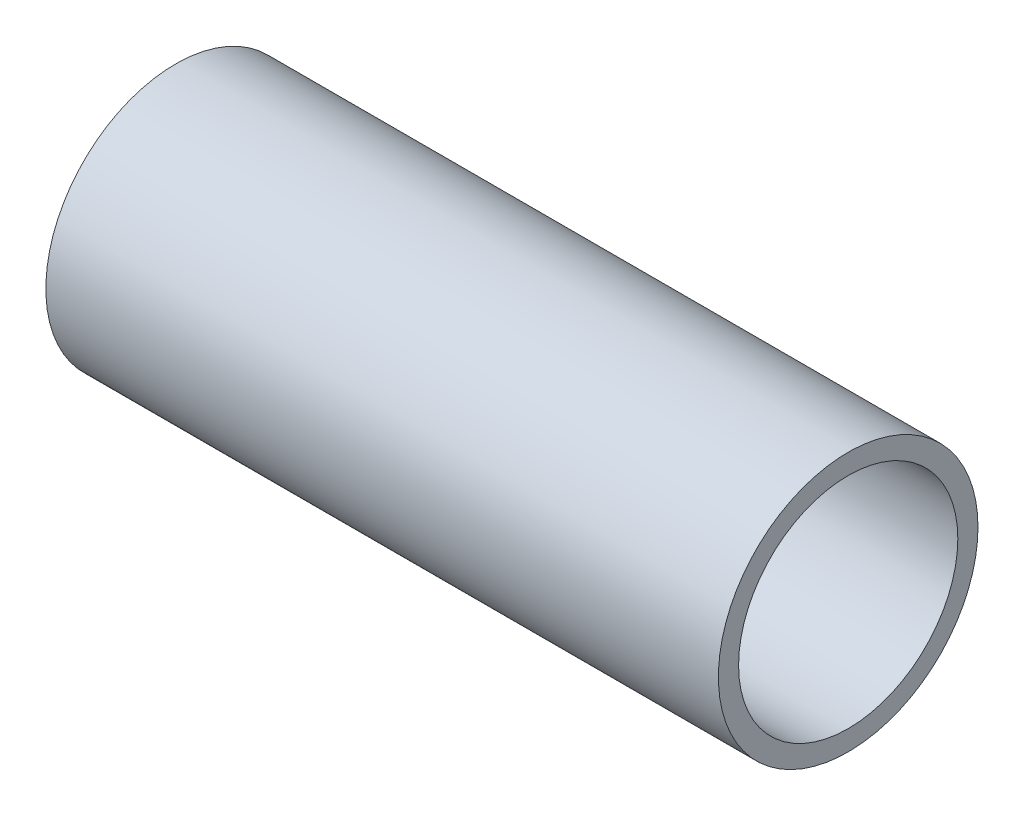
from build123d import *

# Parameters (mm, degrees)
CROQUIS1_R              = 9.65
CROQUIS1_R_2            = 8.15
SALIENTE_EXTRUIR1_DEPTH = 50


with BuildPart() as part:
    # Croquis1 → Saliente-Extruir1 (new body)
    with BuildSketch(Plane(origin=(0, 0, 0), x_dir=(0, 0, -1), z_dir=(1, 0, 0))):
        Circle(CROQUIS1_R)
        Circle(CROQUIS1_R_2, mode=Mode.SUBTRACT)
    extrude(amount=-SALIENTE_EXTRUIR1_DEPTH)


solid = part.part
